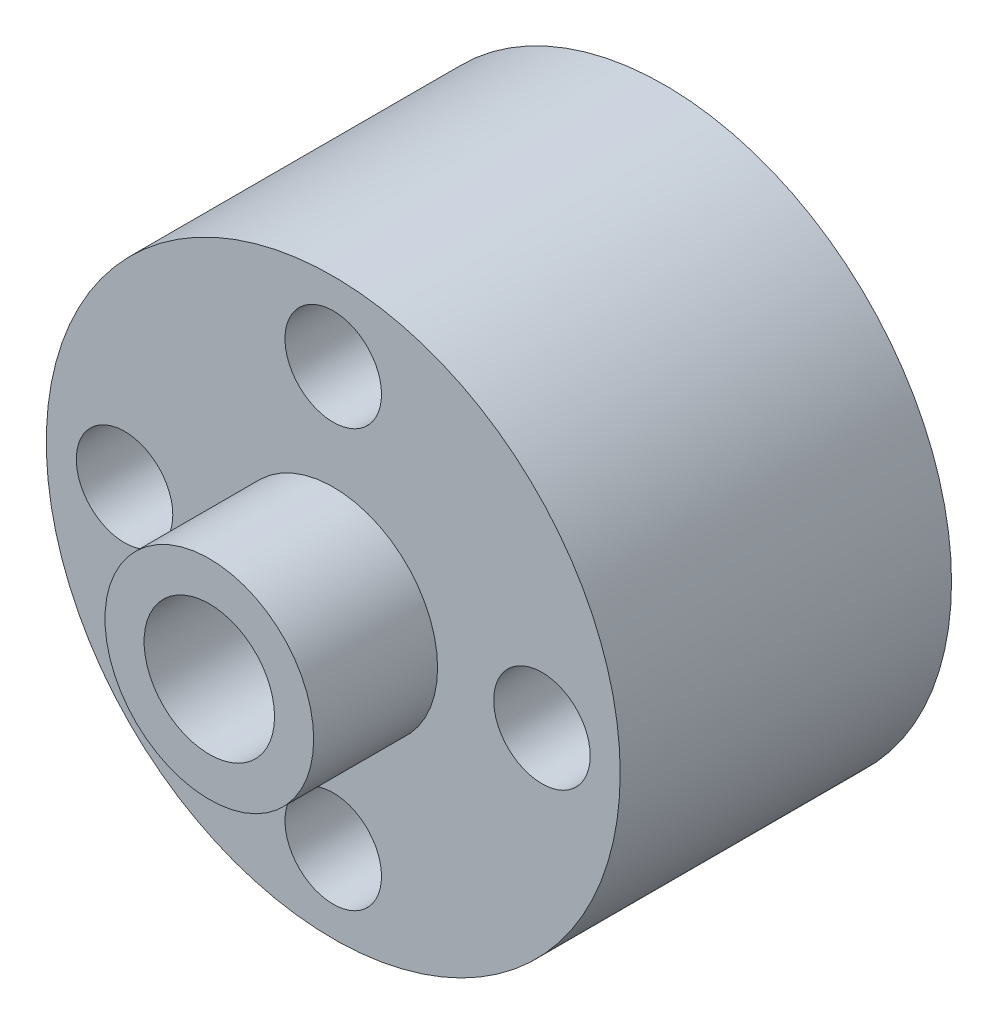
from build123d import *

# Parameters (mm, degrees)
SKETCH1_R           = 11
BOSS_EXTRUDE1_DEPTH = 6.35
SKETCH3_R           = 1.85
CUT_EXTRUDE1_DEPTH  = 21.082081565
SKETCH6_R           = 4
BOSS_EXTRUDE2_DEPTH = 4.75
SKETCH8_R           = 2.5
CUT_EXTRUDE2_DEPTH  = 28.107932418


with BuildPart() as part:
    # Sketch1 → Boss-Extrude1 (new, symmetric)
    with BuildSketch(Plane.XY):
        Circle(SKETCH1_R)
    extrude(amount=BOSS_EXTRUDE1_DEPTH, both=True)

    # Sketch3 → Cut-Extrude1 (cut, through all)
    with BuildSketch(Plane.XY.offset(6.35)):
        with Locations((8, 0)):
            Circle(SKETCH3_R)
        with Locations((-8, 0)):
            Circle(SKETCH3_R)
        with Locations((0, -8)):
            Circle(SKETCH3_R)
        with Locations((0, 8)):
            Circle(SKETCH3_R)
    extrude(amount=-CUT_EXTRUDE1_DEPTH, mode=Mode.SUBTRACT)

    # Sketch6 → Boss-Extrude2 (add)
    with BuildSketch(Plane.XY.offset(6.35)):
        Circle(SKETCH6_R)
    boss_extrude2 = extrude(amount=BOSS_EXTRUDE2_DEPTH)

    # Mirror1: Boss-Extrude2 across plane
    add(boss_extrude2.mirror(Plane.XY))

    # Sketch8 → Cut-Extrude2 (cut, through all)
    with BuildSketch(Plane.XY.offset(11.1)):
        Circle(SKETCH8_R)
    extrude(amount=-CUT_EXTRUDE2_DEPTH, mode=Mode.SUBTRACT)


solid = part.part
